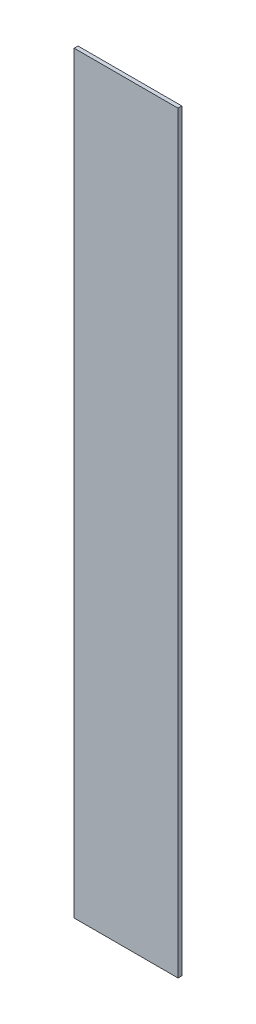
from build123d import *

# Parameters (mm, degrees)
SKETCH1_W           = 342.9
SKETCH1_H           = 2489.2
BOSS_EXTRUDE1_DEPTH = 12.7


with BuildPart() as part:
    # Sketch1 → Boss-Extrude1 (new body)
    with BuildSketch(Plane.XY):
        Rectangle(SKETCH1_W, SKETCH1_H)
    extrude(amount=BOSS_EXTRUDE1_DEPTH)


solid = part.part
